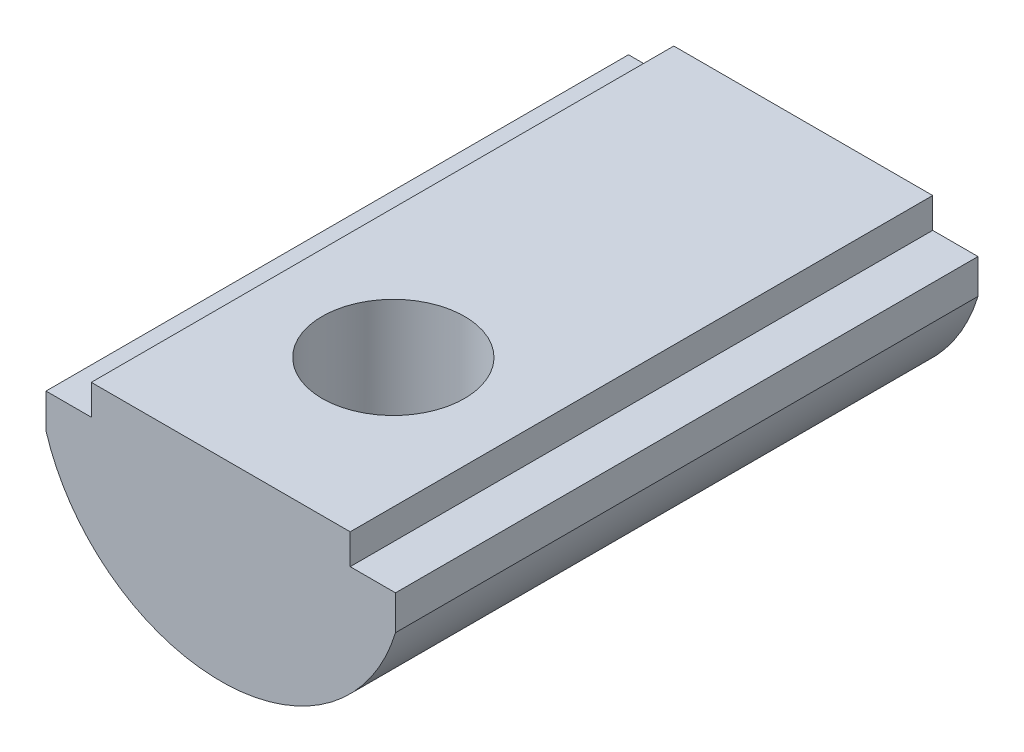
from build123d import *

# Parameters (mm, degrees)
BOSS_EXTRU_1_DEPTH                        = 13.5
TROU_POUR_TARAUDAGE_POUR_TROU_TARAUD_M4_D = 3.3


with BuildPart() as part:
    # Esquisse1 → Boss.-Extru.1 (new body)
    with BuildSketch(Plane.XY):
        with BuildLine():
            Line((-3, 0), (3, 0))
            Line((3, 0), (3, -0.7))
            Line((3, -0.7), (4.05, -0.7))
            Line((4.05, -0.7), (4.05, -1.5))
            ThreePointArc((4.05, -1.5), (0, -4.5), (-4.05, -1.5))
            Line((-4.05, -1.5), (-4.05, -0.7))
            Line((-4.05, -0.7), (-3, -0.7))
            Line((-3, -0.7), (-3, 0))
        make_face()
    extrude(amount=BOSS_EXTRU_1_DEPTH)

    # Trou pour taraudage pour trou taraudé M41 (through all)
    with Locations(Plane(origin=(0, 0, 0), x_dir=(1, 0, 0), z_dir=(0, 1, 0))):
        with Locations((0, -9.5)):
            Hole(TROU_POUR_TARAUDAGE_POUR_TROU_TARAUD_M4_D / 2)

    # Esquisse4 → Révolution1 (revolve)
    with BuildSketch(Plane(origin=(0, 0, 0), x_dir=(0, 0, -1), z_dir=(1, 0, 0))):
        with BuildLine():
            Line((-3, -3.3), (-3, -5.3))
            ThreePointArc((-3, -5.3), (-2, -4.3), (-3, -3.3))
        make_face()
    revolve(axis=Axis((0, -3.3, 3), (0, -1, 0)))


solid = part.part
